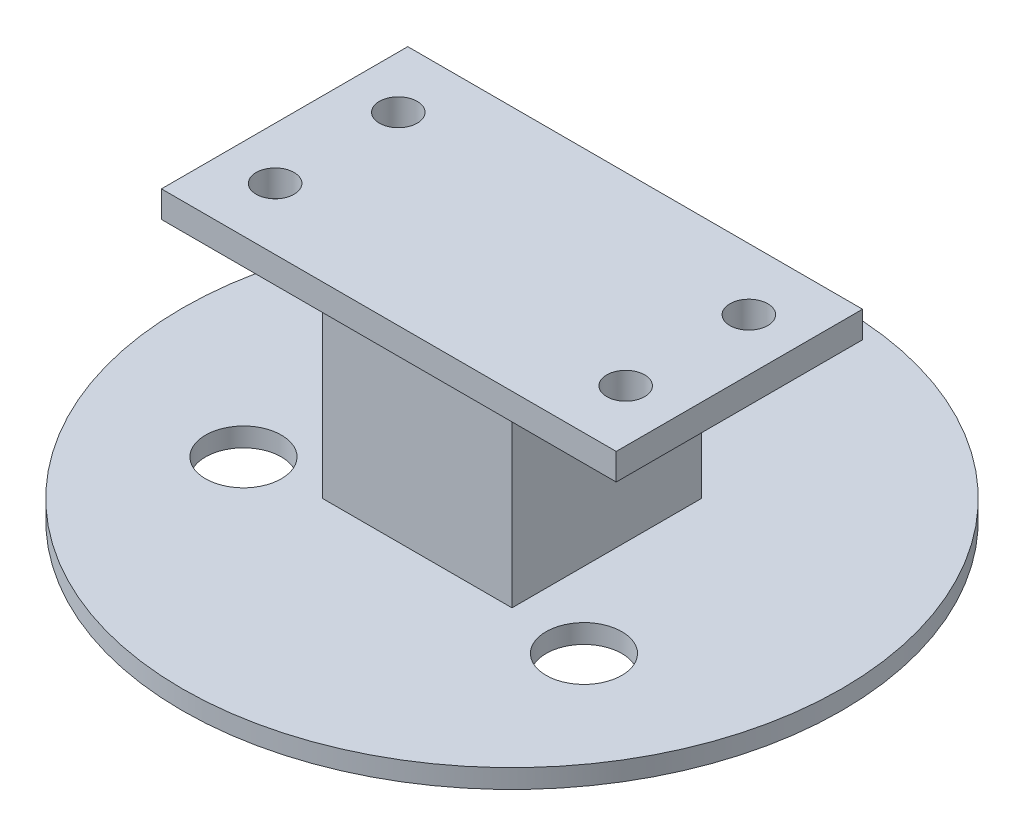
from build123d import *

# Parameters (mm, degrees)
SKETCH1_R           = 87
SKETCH1_R_2         = 10
BOSS_EXTRUDE1_DEPTH = 5
SKETCH2_W           = 50
SKETCH2_H           = 50
BOSS_EXTRUDE2_DEPTH = 50
SKETCH3_W           = 120
SKETCH3_H           = 65
SKETCH3_R           = 5
BOSS_EXTRUDE3_DEPTH = 7


with BuildPart() as part:
    # Sketch1 → Boss-Extrude1 (new body)
    with BuildSketch(Plane(origin=(0, 0, 0), x_dir=(1, 0, 0), z_dir=(0, 1, 0))):
        with Locations(Location((0, 0, 0), (0, 0, 270))):
            Circle(SKETCH1_R)
        with Locations(Location((0, 51.875, 0), (0, 0, 270))):
            Circle(SKETCH1_R_2, mode=Mode.SUBTRACT)
        with Locations(Location((44.926567821, -25.936633975, 0), (0, 0, 270))):
            Circle(SKETCH1_R_2, mode=Mode.SUBTRACT)
        with Locations(Location((-44.923567821, -25.938366025, 0), (0, 0, 270))):
            Circle(SKETCH1_R_2, mode=Mode.SUBTRACT)
    extrude(amount=BOSS_EXTRUDE1_DEPTH)

    # Sketch2 → Boss-Extrude2 (add)
    with BuildSketch(Plane(origin=(0, 5, 0), x_dir=(1, 0, 0), z_dir=(0, 1, 0))):
        Rectangle(SKETCH2_W, SKETCH2_H)
    extrude(amount=BOSS_EXTRUDE2_DEPTH)

    # Sketch3 → Boss-Extrude3 (add)
    with BuildSketch(Plane(origin=(0, 55, 0), x_dir=(1, 0, 0), z_dir=(0, 1, 0))):
        Rectangle(SKETCH3_W, SKETCH3_H)
        with Locations(Location((-46.25, -16.25, 0), (0, 0, 270))):
            Circle(SKETCH3_R, mode=Mode.SUBTRACT)
        with Locations(Location((-46.25, 16.25, 0), (0, 0, 90))):
            Circle(SKETCH3_R, mode=Mode.SUBTRACT)
        with Locations(Location((46.25, -16.25, 0), (0, 0, 90))):
            Circle(SKETCH3_R, mode=Mode.SUBTRACT)
        with Locations(Location((46.25, 16.25, 0), (0, 0, 270))):
            Circle(SKETCH3_R, mode=Mode.SUBTRACT)
    extrude(amount=BOSS_EXTRUDE3_DEPTH)


solid = part.part
